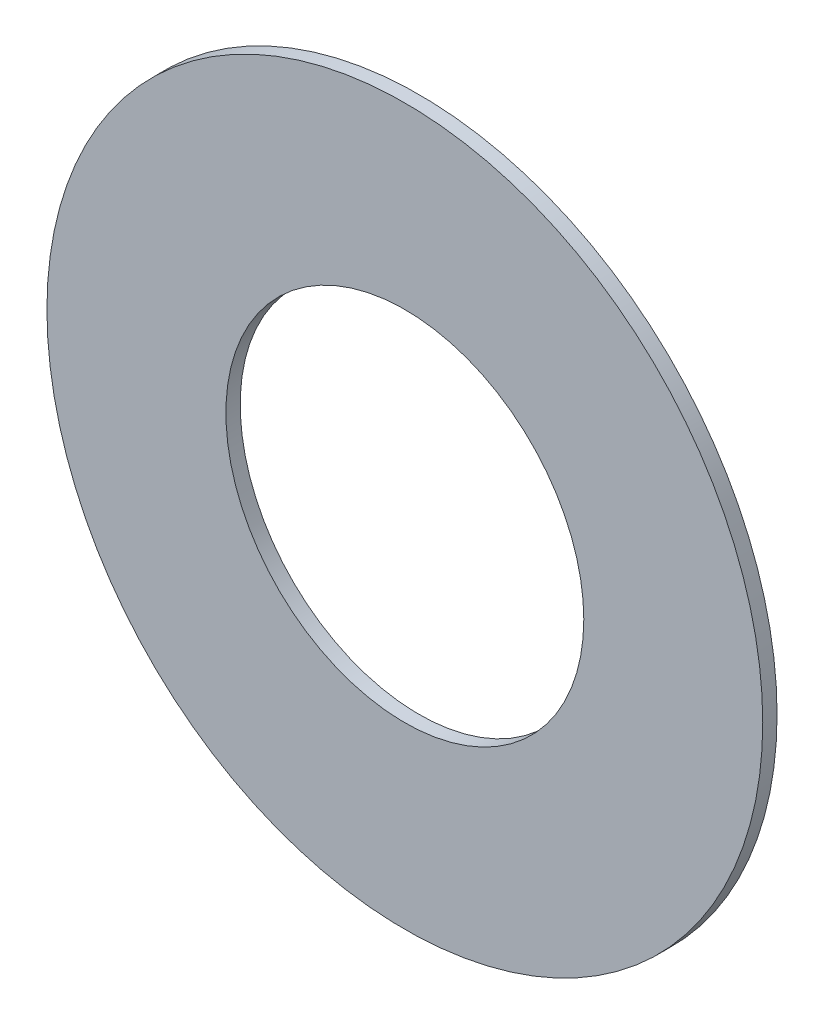
from build123d import *

# Parameters (mm, degrees)
SKETCH1_R           = 50
SKETCH1_R_2         = 25
BOSS_EXTRUDE1_DEPTH = 2


with BuildPart() as part:
    # Sketch1 → Boss-Extrude1 (new body)
    with BuildSketch(Plane.XY):
        Circle(SKETCH1_R)
        Circle(SKETCH1_R_2, mode=Mode.SUBTRACT)
    extrude(amount=BOSS_EXTRUDE1_DEPTH)


solid = part.part
